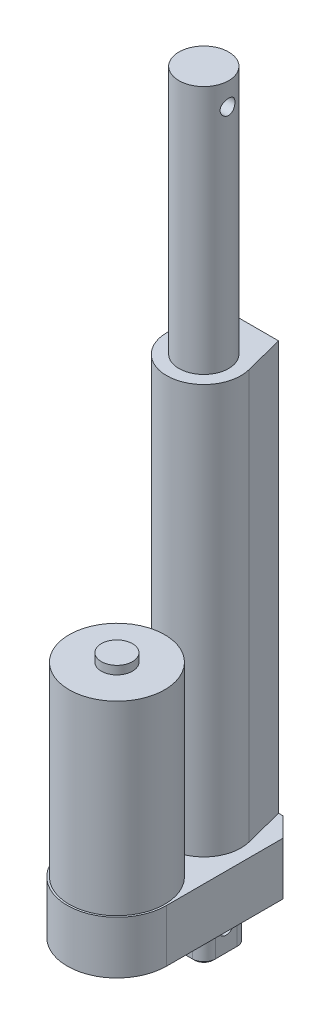
from build123d import *

# Parameters (mm, degrees)
SKETCH1_W                                    = 39.8018
SKETCH1_H                                    = 74.3712
BOSS_EXTRUDE1_SHOWN_IS_A_4_INCH_ACTUAT_DEPTH = 21.1074
FILLET1_RADIUS                               = 19.9009
FILLET1_LENGTH                               = 21.1074
CHAMFER1_SIZE                                = 7.7216
SKETCH2_R                                    = 19.1516
BOSS_EXTRUDE2_DEPTH                          = 74.5236
SKETCH3_R                                    = 6.2484
BOSS_EXTRUDE3_DEPTH                          = 3.3274
SKETCH4_W                                    = 17.8308
SKETCH4_H                                    = 17.8308
BOSS_EXTRUDE4_DEPTH                          = 19.0246
SKETCH5_R                                    = 2.9718
CUT_EXTRUDE1_DEPTH                           = 110.571496858
FILLET2_R                                    = 4.572
CHAMFER3_SIZE                                = 0.762
BODY_EXTRUDE_DEPTH                           = 164.08146
SKETCH7_R                                    = 9.9695
SHAFT_EXTRUDE_DEPTH                          = 100
SKETCH8_R                                    = 2.9845
CUT_EXTRUDE2_DEPTH                           = 12.7


with BuildPart() as part:
    # Sketch1 → Boss-Extrude1 - Shown is a 4 Inch Actuator (new body)
    with BuildSketch(Plane(origin=(0, 0, 0), x_dir=(1, 0, 0), z_dir=(0, 1, 0))):
        Rectangle(SKETCH1_W, SKETCH1_H)
    extrude(amount=BOSS_EXTRUDE1_SHOWN_IS_A_4_INCH_ACTUAT_DEPTH)

    # Fillet1: full round fillet: the end face becomes a half cylinder, R = half its width
    fillet1_face = Plane((0, 10.5537, 37.1856), x_dir=(0, 1, 0), z_dir=(0, 0, 1))  # on the end face: x along it, z out of the body
    fillet1_slab = fillet1_face.offset(-FILLET1_RADIUS / 2) * Box(FILLET1_LENGTH, 2 * FILLET1_RADIUS, FILLET1_RADIUS, mode=Mode.PRIVATE)  # the body's end, R deep
    fillet1_round = Plane((0, 10.5537, 17.2847), x_dir=(0, 0, 1), z_dir=(0, 1, 0)) * Cylinder(FILLET1_RADIUS, FILLET1_LENGTH, mode=Mode.PRIVATE)  # its axis R under the face
    add(fillet1_slab - fillet1_round, mode=Mode.SUBTRACT)

    # Chamfer1
    chamfer1_edges = [part.edges().sort_by_distance(p)[0] for p in [
        (-19.9009, 10.5537, -37.1856),
        (19.9009, 10.5537, -37.1856),
    ]]
    chamfer(chamfer1_edges, length=CHAMFER1_SIZE)

    # Sketch2 → Boss-Extrude2 (add)
    with BuildSketch(Plane(origin=(0, 21.1074, 0), x_dir=(1, 0, 0), z_dir=(0, 1, 0))):
        with Locations(Location((0, -17.2847, 0), (0, 0, 270))):
            Circle(SKETCH2_R)
    extrude(amount=BOSS_EXTRUDE2_DEPTH)

    # Sketch3 → Boss-Extrude3 (add)
    with BuildSketch(Plane(origin=(0, 95.631, 0), x_dir=(1, 0, 0), z_dir=(0, 1, 0))):
        with Locations(Location((0, -17.2847, 0), (0, 0, 270))):
            Circle(SKETCH3_R)
    extrude(amount=BOSS_EXTRUDE3_DEPTH)

    # Sketch4 → Boss-Extrude4 (add)
    with BuildSketch(Plane.XZ):
        with Locations((0, -17.6022)):
            Rectangle(SKETCH4_W, SKETCH4_H)
    extrude(amount=BOSS_EXTRUDE4_DEPTH)

    # Sketch5 → Cut-Extrude1 (cut, through all)
    with BuildSketch(Plane(origin=(8.9154, 0, 0), x_dir=(0, 0, -1), z_dir=(1, 0, 0))):
        with Locations((17.6022, -9.1694)):
            Circle(SKETCH5_R)
    extrude(amount=-CUT_EXTRUDE1_DEPTH, mode=Mode.SUBTRACT)

    # Fillet2
    fillet2_edges = [part.edges().sort_by_distance(p)[0] for p in [
        (8.9154, -9.5123, -26.5176),
        (8.9154, -9.5123, -8.6868),
        (-8.9154, -9.5123, -8.6868),
        (-8.9154, -9.5123, -26.5176),
    ]]
    fillet(fillet2_edges, radius=FILLET2_R)

    # Chamfer3
    chamfer3_edges = [part.edges().sort_by_distance(p)[0] for p in [
        (0, -19.0246, -26.5176),
        (-8.9154, -19.0246, -17.6022),
        (8.9154, -19.0246, -17.6022),
        (0, -19.0246, -8.6868),
        (7.576292204, -19.0246, -10.025907796),
        (7.576292204, -19.0246, -25.178492204),
        (-7.576292204, -19.0246, -10.025907796),
        (-7.576292204, -19.0246, -25.178492204),
    ]]
    chamfer(chamfer3_edges, length=CHAMFER3_SIZE)

    # Sketch6 → Body Extrude (add)
    with BuildSketch(Plane(origin=(0, 21.1074, 0), x_dir=(1, 0, 0), z_dir=(0, 1, 0))):
        with BuildLine():
            Line((0, 37.1856), (-10.3378, 37.1856))
            Line((-10.3378, 37.1856), (-14.428797676, 21.257258339))
            ThreePointArc((-14.428797676, 21.257258339), (0, 2.6543), (14.428797676, 21.257258339))
            Line((14.428797676, 21.257258339), (10.3378, 37.1856))
            Line((10.3378, 37.1856), (0, 37.1856))
        make_face()
    extrude(amount=BODY_EXTRUDE_DEPTH)

    # Sketch7 → Shaft Extrude (add)
    with BuildSketch(Plane(origin=(0, 185.18886, 0), x_dir=(1, 0, 0), z_dir=(0, 1, 0))):
        with Locations(Location((0, 17.5514, 0), (0, 0, 270))):
            Circle(SKETCH7_R)
    extrude(amount=SHAFT_EXTRUDE_DEPTH)

    # Sketch8 → Cut-Extrude2 (cut, symmetric)
    with BuildSketch(Plane(origin=(0, 0, 0), x_dir=(0, 0, -1), z_dir=(1, 0, 0))):
        with Locations((17.5514, 276.08296)):
            Circle(SKETCH8_R)
    extrude(amount=CUT_EXTRUDE2_DEPTH, both=True, mode=Mode.SUBTRACT)


solid = part.part
